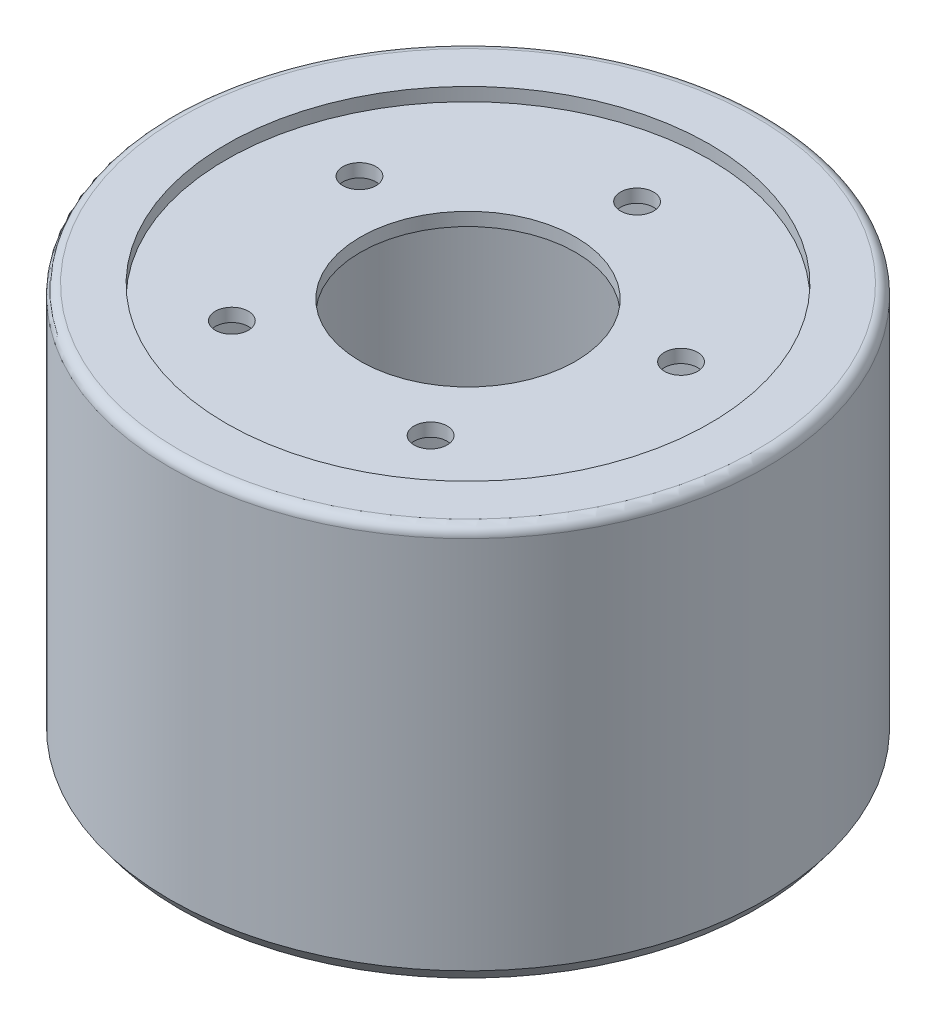
from build123d import *

# Parameters (mm, degrees)
SKETCH3_R           = 45
SKETCH3_R_2         = 36.5
BOSS_EXTRUDE1_DEPTH = 60
FILLET1_R           = 1.5
BOSS_EXTRUDE3_START = 56
SKETCH3_6_R         = 36.5
SKETCH3_6_R_2       = 2.5
SKETCH3_6_R_3       = 16.25
BOSS_EXTRUDE3_DEPTH = 2
CHAMFER2_SIZE       = 1.5
CHAMFER2_SIZE2      = 2


with BuildPart() as part:
    # Sketch3 → Boss-Extrude1 (new body)
    with BuildSketch(Plane(origin=(0, 0, 0), x_dir=(1, 0, 0), z_dir=(0, 1, 0))):
        Circle(SKETCH3_R)
        Circle(SKETCH3_R_2, mode=Mode.SUBTRACT)
    extrude(amount=BOSS_EXTRUDE1_DEPTH)

    # Fillet1
    fillet1_edges = [part.edges().sort_by_distance(p)[0] for p in [
        (-45, 60, 0),
    ]]
    fillet(fillet1_edges, radius=FILLET1_R)

    # Sketch3<6> → Boss-Extrude3 (add)
    with BuildSketch(Plane(origin=(0, 0, 0), x_dir=(1, 0, 0), z_dir=(0, 1, 0)).offset(BOSS_EXTRUDE3_START)):
        Circle(SKETCH3_6_R)
        with Locations((-15.000279639, -20.646113696)):
            Circle(SKETCH3_6_R_2, mode=Mode.SUBTRACT)
        with Locations((15.000279639, -20.646113696)):
            Circle(SKETCH3_6_R_2, mode=Mode.SUBTRACT)
        with Locations((-24.270962296, 7.886113696)):
            Circle(SKETCH3_6_R_2, mode=Mode.SUBTRACT)
        Circle(SKETCH3_6_R_3, mode=Mode.SUBTRACT)
        with Locations((24.270962296, 7.886113696)):
            Circle(SKETCH3_6_R_2, mode=Mode.SUBTRACT)
        with Locations((0, 25.52)):
            Circle(SKETCH3_6_R_2, mode=Mode.SUBTRACT)
    extrude(amount=BOSS_EXTRUDE3_DEPTH)

    # Chamfer2
    chamfer2_edges = [part.edges().sort_by_distance(p)[0] for p in [
        (-45, 0, 0),
    ]]
    chamfer2_side = [part.faces().sort_by_distance(p)[0] for p in [
        (-43.727207794, 0, 0),
    ]]
    chamfer(chamfer2_edges, length=CHAMFER2_SIZE, length2=CHAMFER2_SIZE2, reference=chamfer2_side[0])


solid = part.part
